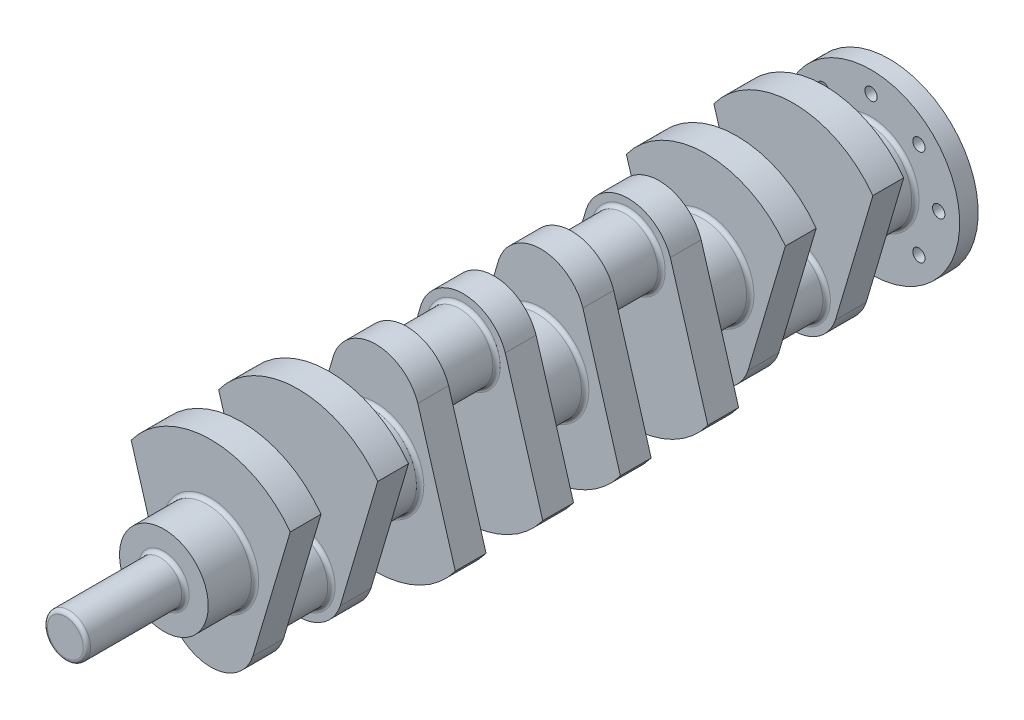
from build123d import *

# Parameters (mm, degrees)
BOSS_EXTRUDE1_DEPTH   = 25
SKETCH2_R             = 27
BOSS_EXTRUDE2_DEPTH   = 46
SKETCH3_R             = 36
BOSS_EXTRUDE3_DEPTH   = 38
BODY_MOVE_COPY2_ANGLE = 180
SKETCH4_R             = 17.5
BOSS_EXTRUDE4_DEPTH   = 80
SKETCH5_R             = 72
SKETCH5_R_2           = 5
BOSS_EXTRUDE5_DEPTH   = 15
FILLET1_R             = 3


with BuildPart() as part:
    # Sketch1 → Boss-Extrude1 (new body)
    with BuildSketch(Plane.XY):
        with BuildLine():
            ThreePointArc((64.55234168, 47.25457844), (0, 80), (-64.55234168, 47.25457844))
            Line((-64.55234168, 47.25457844), (-34.865330037, -52.967093253))
            ThreePointArc((-34.865330037, -52.967093253), (-4.519298544, -8.284793985), (36, -44))
            ThreePointArc((36, -44), (35.715206015, -48.519298544), (34.865330037, -52.967093253))
            Line((34.865330037, -52.967093253), (64.55234168, 47.25457844))
        make_face()
        with BuildLine():
            ThreePointArc((36, -44), (-4.519298544, -8.284793985), (-34.865330037, -52.967093253))
            Line((-34.865330037, -52.967093253), (-34.12435516, -55.468582516))
            ThreePointArc((-34.12435516, -55.468582516), (0, -80), (34.12435516, -55.468582516))
            Line((34.12435516, -55.468582516), (34.865330037, -52.967093253))
            ThreePointArc((34.865330037, -52.967093253), (35.715206015, -48.519298544), (36, -44))
        make_face()
    boss_extrude1 = extrude(amount=BOSS_EXTRUDE1_DEPTH)

    # Sketch2 → Boss-Extrude2 (add)
    with BuildSketch(Plane(origin=(0, 0, 0), x_dir=(-1, 0, 0), z_dir=(0, 0, -1))):
        with Locations(Location((0, -44, 0), (0, 0, 180))):
            Circle(SKETCH2_R)
    extrude(amount=BOSS_EXTRUDE2_DEPTH)

    # Sketch3 → Boss-Extrude3 (add)
    with BuildSketch(Plane.XY.offset(25)):
        Circle(SKETCH3_R)
    boss_extrude3 = extrude(amount=BOSS_EXTRUDE3_DEPTH)

    # Mirror1: Boss-Extrude1, Boss-Extrude3 across plane
    add(boss_extrude1.mirror(Plane(origin=(0, 0, -23), x_dir=(1, 0, 0), z_dir=(0, 0, -1))))
    add(boss_extrude3.mirror(Plane(origin=(0, 0, -23), x_dir=(1, 0, 0), z_dir=(0, 0, -1))))


with BuildPart() as body_2:
    # Mirror2: mirrored copy
    add(part.part.mirror(Plane.XY.offset(44)))


with BuildPart() as body_2_1:
    # Body-Move/Copy2: moved
    add(body_2.part.rotate(Axis((0, 0, 111), (1, 0, 0)), BODY_MOVE_COPY2_ANGLE))


with BuildPart() as body_3:
    # Mirror3: mirrored copy
    add(part.part.mirror(Plane.XY.offset(178)))

    # Sketch4 → Boss-Extrude4 (add)
    with BuildSketch(Plane.XY.offset(465)):
        Circle(SKETCH4_R)
    extrude(amount=BOSS_EXTRUDE4_DEPTH)


with BuildPart() as body_4:
    # Mirror3 2: mirrored copy
    add(body_2_1.part.mirror(Plane.XY.offset(178)))


with BuildPart() as part_1:
    add(part.part)

    # Sketch5 → Boss-Extrude5 (add)
    with BuildSketch(Plane(origin=(0, 0, -109), x_dir=(-1, 0, 0), z_dir=(0, 0, -1))):
        Circle(SKETCH5_R)
        with Locations((0, 55)):
            Circle(SKETCH5_R_2, mode=Mode.SUBTRACT)
        with Locations((38.890872965, 38.890872965)):
            Circle(SKETCH5_R_2, mode=Mode.SUBTRACT)
        with Locations((55, 0)):
            Circle(SKETCH5_R_2, mode=Mode.SUBTRACT)
        with Locations((38.890872965, -38.890872965)):
            Circle(SKETCH5_R_2, mode=Mode.SUBTRACT)
        with Locations((0, -55)):
            Circle(SKETCH5_R_2, mode=Mode.SUBTRACT)
        with Locations((-38.890872965, -38.890872965)):
            Circle(SKETCH5_R_2, mode=Mode.SUBTRACT)
        with Locations((-55, 0)):
            Circle(SKETCH5_R_2, mode=Mode.SUBTRACT)
        with Locations((-38.890872965, 38.890872965)):
            Circle(SKETCH5_R_2, mode=Mode.SUBTRACT)
    extrude(amount=BOSS_EXTRUDE5_DEPTH)


with BuildPart() as body_3_1:
    add(body_3.part)

    # Combine1: union body 4, body 2, part
    add(body_4.part)
    add(body_2_1.part)
    add(part_1.part)

    # Fillet1
    fillet1_edges = [body_3_1.edges().sort_by_distance(p)[0] for p in [
        (-27, -44, 356),
        (-27, -44, 402),
        (-36, 0, 331),
        (-36, 0, 427),
        (-17.5, 0, 465),
        (-17.5, 0, 545),
        (-27, 44, 222),
        (-36, 0, 197),
        (-36, 0, 293),
        (-27, 44, 268),
        (-36, 0, 159),
        (-27, 44, 134),
        (-27, 44, 88),
        (-36, 0, 63),
        (-36, 0, 25),
        (-27, -44, 0),
        (-36, 0, -71),
        (-27, -44, -46),
        (-36, 0, -109),
    ]]
    fillet(fillet1_edges, radius=FILLET1_R)


solid = body_3_1.part
